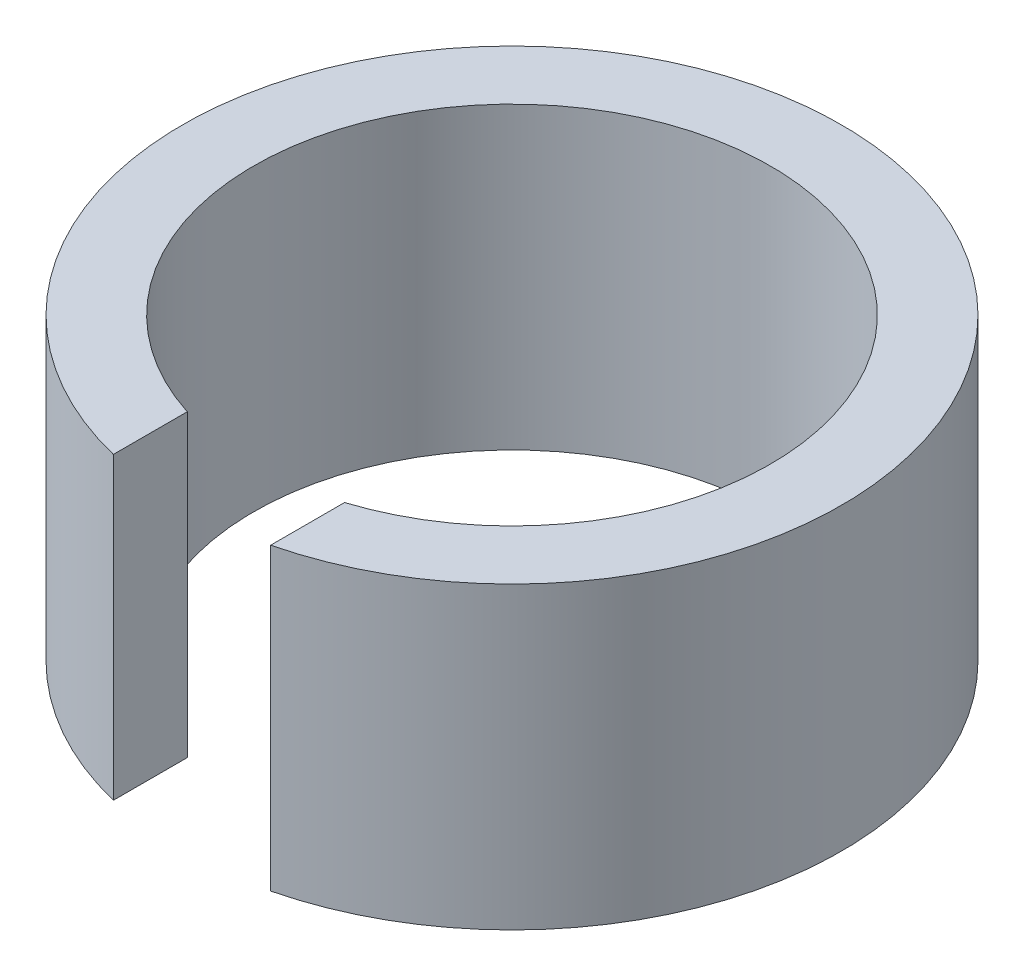
from build123d import *

# Parameters (mm, degrees)
BOSS_EXTRUDE1_DEPTH = 4


with BuildPart() as part:
    # Sketch1 → Boss-Extrude1 (new body)
    with BuildSketch(Plane(origin=(0, 0, 0), x_dir=(1, 0, 0), z_dir=(0, 1, 0))):
        with BuildLine():
            Line((-1.05, -4.272879591), (-1.05, -3.286335345))
            ThreePointArc((-1.05, -3.286335345), (-2.034698995, 2.786126343), (3.45, 0))
            ThreePointArc((3.45, 0), (2.786126343, -2.034698995), (1.05, -3.286335345))
            Line((1.05, -3.286335345), (1.05, -4.272879591))
            ThreePointArc((1.05, -4.272879591), (3.462657939, -2.714774392), (4.4, 0))
            ThreePointArc((4.4, 0), (-2.714774392, 3.462657939), (-1.05, -4.272879591))
        make_face()
    extrude(amount=BOSS_EXTRUDE1_DEPTH)


solid = part.part
